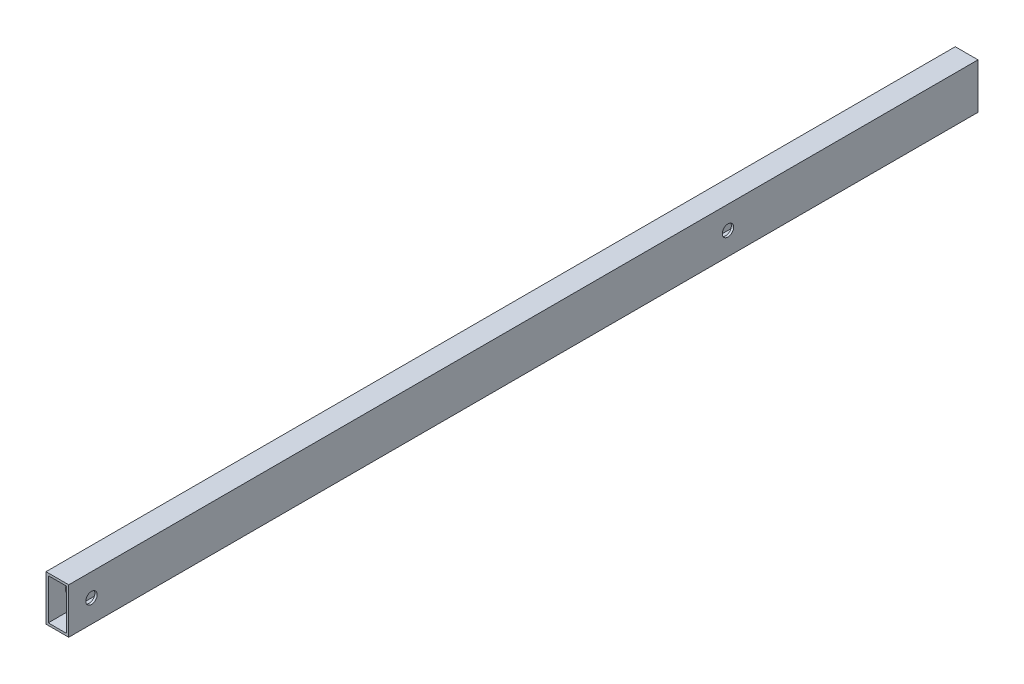
from build123d import *

# Parameters (mm, degrees)
SKETCH1_W           = 10
SKETCH1_H           = 20
SKETCH1_W_2         = 8
SKETCH1_H_2         = 18
BOSS_EXTRUDE1_DEPTH = 400
SKETCH2_R           = 2.5
CUT_EXTRUDE1_DEPTH  = 401.249921924


with BuildPart() as part:
    # Sketch1 → Boss-Extrude1 (new body)
    with BuildSketch(Plane.XY):
        Rectangle(SKETCH1_W, SKETCH1_H)
        Rectangle(SKETCH1_W_2, SKETCH1_H_2, mode=Mode.SUBTRACT)
    extrude(amount=BOSS_EXTRUDE1_DEPTH)

    # Sketch2 → Cut-Extrude1 (cut, through all)
    with BuildSketch(Plane(origin=(5, 0, 0), x_dir=(0, 0, -1), z_dir=(1, 0, 0))):
        with Locations((-110, 0)):
            Circle(SKETCH2_R)
        with Locations((-390, 0)):
            Circle(SKETCH2_R)
    extrude(amount=-CUT_EXTRUDE1_DEPTH, mode=Mode.SUBTRACT)


solid = part.part
